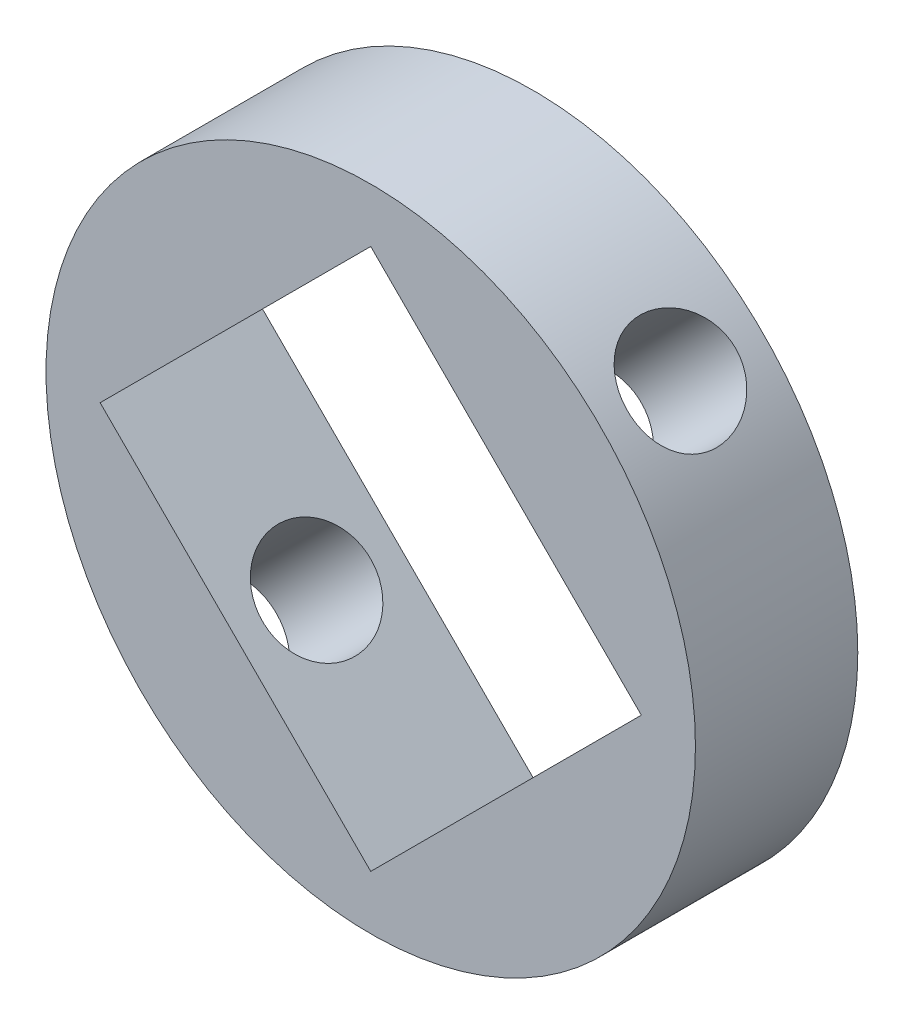
from build123d import *

# Parameters (mm, degrees)
SKETCH_1_R          = 12
EXTRUDE_1_DEPTH     = 6
CUT_EXTRUDE_1_DEPTH = 10
CUT_EXTRUDE_6_DEPTH = 11
CUT_EXTRUDE_START   = -11
CUT_EXTRUDE_7_DEPTH = 11


with BuildPart() as part:
    # 草图1 → 凸台-拉伸1 (new body)
    with BuildSketch(Plane.XY):
        Circle(SKETCH_1_R)
    extrude(amount=-EXTRUDE_1_DEPTH)

    # 草图2 → 切除-拉伸1 (cut)
    with BuildSketch(Plane.XY):
        Polygon((10, 0), (0, 10), (-10, 0), (0, -10), align=None)
    extrude(amount=-CUT_EXTRUDE_1_DEPTH, mode=Mode.SUBTRACT)

    # 草图7 → 切除-拉伸6 (cut)
    with BuildSketch(Plane(origin=(5, 5, 0), x_dir=(0, 0, 1), z_dir=(-0.7071067811865477, -0.7071067811865475, 0))):
        with BuildLine():
            ThreePointArc((-1, 0), (-3, 2), (-5, 0))
            Line((-5, 0), (-1, 0))
        make_face()
        with BuildLine():
            Line((-1, 0), (-5, 0))
            ThreePointArc((-5, 0), (-3, -2), (-1, 0))
        make_face()
    extrude(amount=-CUT_EXTRUDE_6_DEPTH, mode=Mode.SUBTRACT)

    # 草图8 → 切除-拉伸7 (cut)
    with BuildSketch(Plane(origin=(-5, -5, 0), x_dir=(0, 0, -1), z_dir=(0.7071067811865477, 0.7071067811865475, 0)).offset(CUT_EXTRUDE_START)):
        with BuildLine():
            ThreePointArc((1, 0), (3, -2), (5, 0))
            Line((5, 0), (1, 0))
        make_face()
        with BuildLine():
            Line((1, 0), (5, 0))
            ThreePointArc((5, 0), (3, 2), (1, 0))
        make_face()
    extrude(amount=CUT_EXTRUDE_7_DEPTH, mode=Mode.SUBTRACT)


solid = part.part
